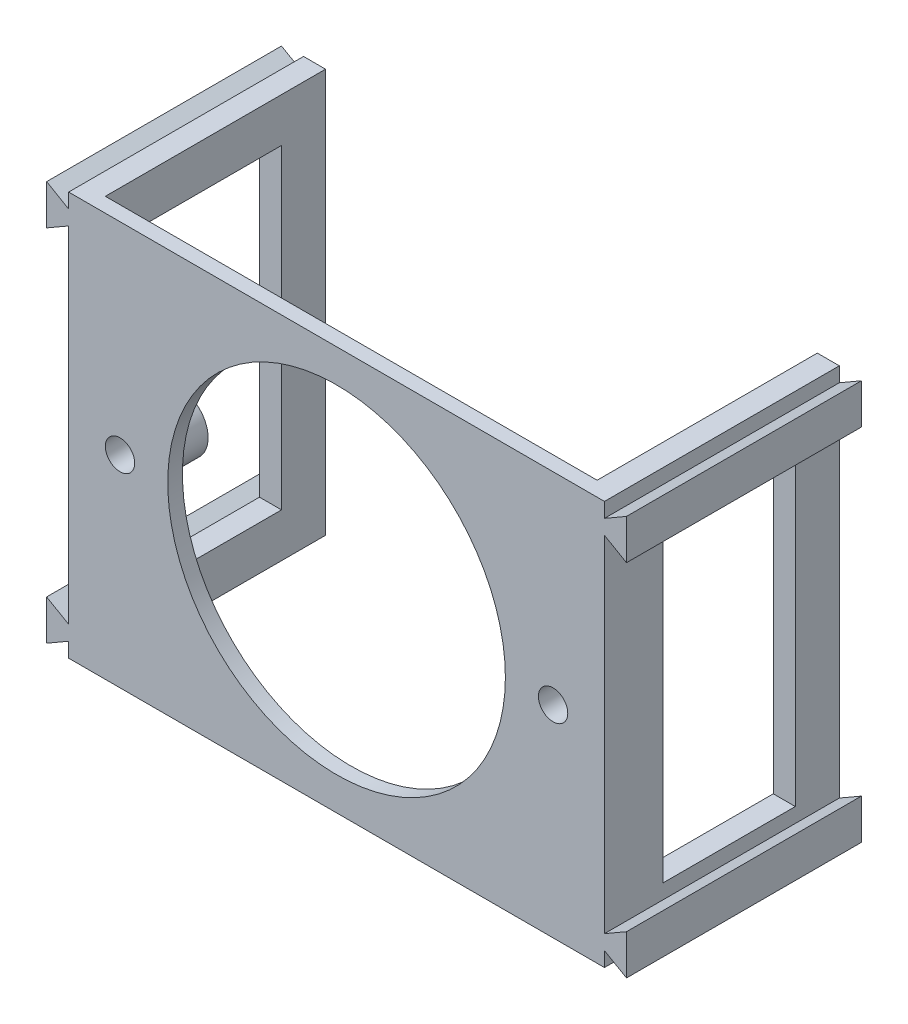
from build123d import *

# Parameters (mm, degrees)
SKETCH2_W           = 36.5
SKETCH2_H           = 27.5
SKETCH2_R           = 11.5
SKETCH2_R_2         = 1
BOSS_EXTRUDE1_DEPTH = 1
SKETCH4_R           = 1
BOSS_EXTRUDE2_DEPTH = 3
SKETCH5_W           = 1.5
SKETCH5_H           = 27.5
BOSS_EXTRUDE3_DEPTH = 12
SKETCH6_W           = 9
SKETCH6_H           = 21.5
CUT_EXTRUDE1_DEPTH  = 1.5
BOSS_EXTRUDE4_DEPTH = 16


with BuildPart() as part:
    # Sketch2 → Boss-Extrude1 (new body)
    with BuildSketch(Plane.XY):
        Rectangle(SKETCH2_W, SKETCH2_H)
        Circle(SKETCH2_R, mode=Mode.SUBTRACT)
        with Locations((-14.75, 0)):
            Circle(SKETCH2_R_2, mode=Mode.SUBTRACT)
        with Locations((14.75, 0)):
            Circle(SKETCH2_R_2, mode=Mode.SUBTRACT)
    extrude(amount=-BOSS_EXTRUDE1_DEPTH)

    # Sketch4 → Boss-Extrude2 (add)
    with BuildSketch(Plane(origin=(0, 0, -1), x_dir=(-1, 0, 0), z_dir=(0, 0, -1))):
        with BuildLine():
            Line((-16.75, 13.75), (-16.75, 4))
            ThreePointArc((-16.75, 4), (-16.164213562, 2.585786438), (-14.75, 2))
            ThreePointArc((-14.75, 2), (-12.75, 0), (-14.75, -2))
            ThreePointArc((-14.75, -2), (-16.164213562, -2.585786438), (-16.75, -4))
            Line((-16.75, -4), (-16.75, -13.75))
            Line((-16.75, -13.75), (-18.25, -13.75))
            Line((-18.25, -13.75), (-18.25, 13.75))
            Line((-18.25, 13.75), (-16.75, 13.75))
        make_face()
        with Locations(Location((-14.75, 0, 0), (0, 0, 180))):
            Circle(SKETCH4_R, mode=Mode.SUBTRACT)
    boss_extrude2 = extrude(amount=BOSS_EXTRUDE2_DEPTH)

    # Sketch5 → Boss-Extrude3 (add)
    with BuildSketch(Plane(origin=(0, 0, -4), x_dir=(-1, 0, 0), z_dir=(0, 0, -1))):
        with Locations((-17.5, 0)):
            Rectangle(SKETCH5_W, SKETCH5_H)
    boss_extrude3 = extrude(amount=BOSS_EXTRUDE3_DEPTH)

    # Sketch6 → Cut-Extrude1 (cut)
    with BuildSketch(Plane(origin=(18.25, 0, 0), x_dir=(0, 0, -1), z_dir=(1, 0, 0))):
        with Locations((8.5, 0)):
            Rectangle(SKETCH6_W, SKETCH6_H)
    cut_extrude1 = extrude(amount=-CUT_EXTRUDE1_DEPTH, mode=Mode.SUBTRACT)

    # Sketch7 → Boss-Extrude4 (add)
    with BuildSketch(Plane(origin=(0, 0, -16), x_dir=(-1, 0, 0), z_dir=(0, 0, -1))):
        Polygon((-18.25, 12.75), (-19.75, 13.616025404), (-19.75, 10.883974596), (-18.25, 11.75), align=None)
        Polygon((-19.75, -10.883974596), (-18.25, -11.75), (-18.25, -12.75), (-19.75, -13.616025404), align=None)
    boss_extrude4 = extrude(amount=-BOSS_EXTRUDE4_DEPTH)

    # Mirror1: Boss-Extrude2, Boss-Extrude3, Cut-Extrude1, Boss-Extrude4 across plane
    add(boss_extrude2.mirror(Plane(origin=(0, 0, 0), x_dir=(0, 0, 1), z_dir=(1, 0, 0))))
    add(boss_extrude3.mirror(Plane(origin=(0, 0, 0), x_dir=(0, 0, 1), z_dir=(1, 0, 0))))
    add(cut_extrude1.mirror(Plane(origin=(0, 0, 0), x_dir=(0, 0, 1), z_dir=(1, 0, 0))), mode=Mode.SUBTRACT)
    add(boss_extrude4.mirror(Plane(origin=(0, 0, 0), x_dir=(0, 0, 1), z_dir=(1, 0, 0))))


solid = part.part
